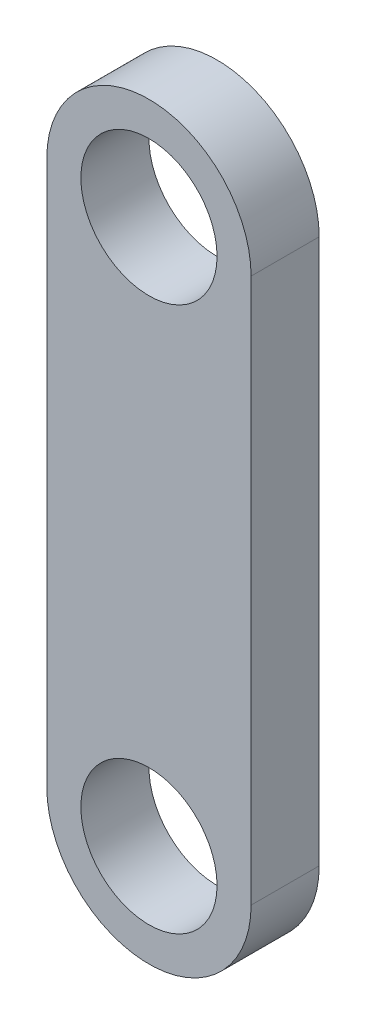
from build123d import *

# Parameters (mm, degrees)
EXTRUDE_1_DEPTH     = 5
SKETCH_2_R          = 5
CUT_EXTRUDE_1_DEPTH = 49.347699015


with BuildPart() as part:
    # 草图1 → 凸台-拉伸1 (new body)
    with BuildSketch(Plane.XY):
        with BuildLine():
            Line((-7.5, 0), (-7.5, 40))
            ThreePointArc((-7.5, 40), (0, 47.5), (7.5, 40))
            Line((7.5, 40), (7.5, 0))
            ThreePointArc((7.5, 0), (0, -7.5), (-7.5, 0))
        make_face()
    extrude(amount=EXTRUDE_1_DEPTH)

    # 草图2 → 切除-拉伸1 (cut, through all)
    with BuildSketch(Plane.XY.offset(5)):
        with Locations((0, 40)):
            Circle(SKETCH_2_R)
        Circle(SKETCH_2_R)
    extrude(amount=-CUT_EXTRUDE_1_DEPTH, mode=Mode.SUBTRACT)


solid = part.part
